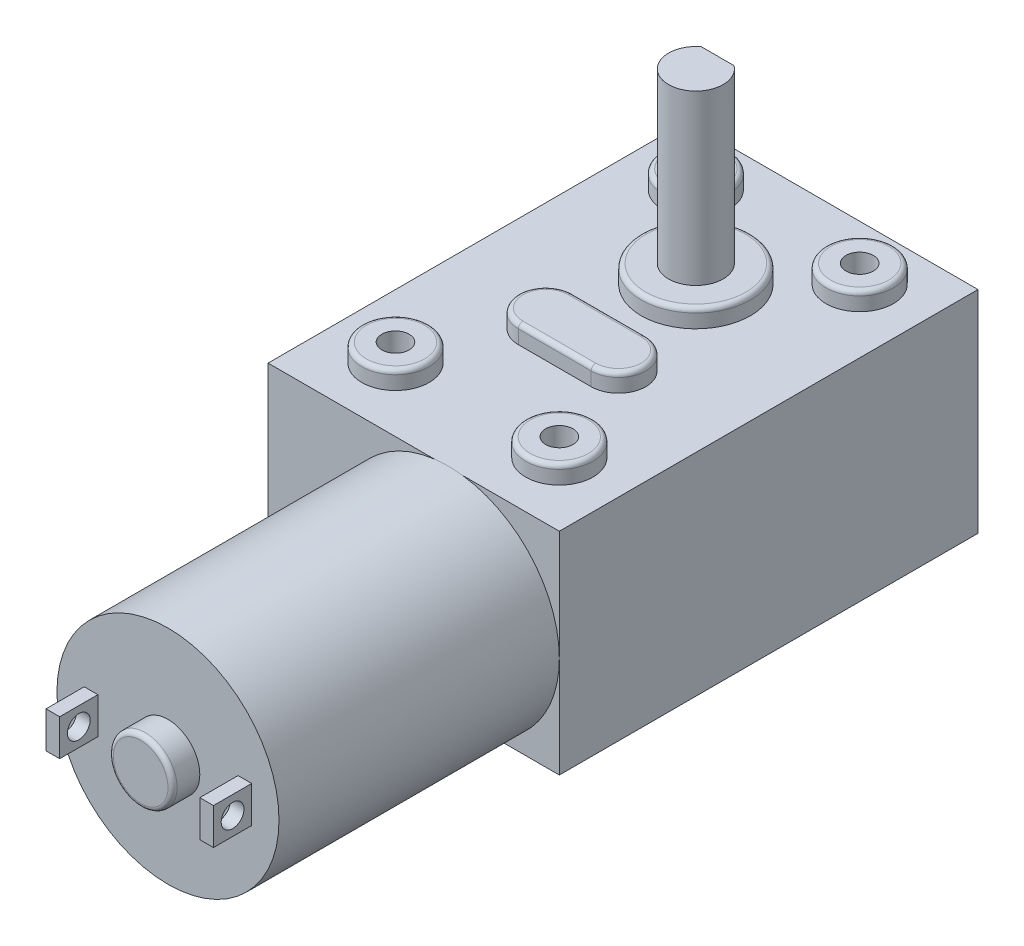
from build123d import *

# Parameters (mm, degrees)
ESBO_O4_R                      = 12.2
RESSALTO_EXTRUS_O3_DEPTH       = 15.4
RESSALTO_EXTRUS_O4_DEPTH       = 12.1
RESSALTO_EXTRUS_O4_DEPTH_BACK  = 11.1
ESBO_O6_W                      = 32
ESBO_O6_H                      = 46
ESBO_O7_R                      = 3.7
ESBO_O7_R_2                    = 6
RESSALTO_EXTRUS_O5_DEPTH       = 2
ESBO_O8_R                      = 3
RESSALTO_EXTRUS_O6_DEPTH       = 18.5
ESBO_O9_W                      = 6
ESBO_O9_H                      = 0.6
CORTE_EXTRUS_O1_DEPTH          = 12
ESBO_O10_R                     = 1.5
CORTE_EXTRUS_O2_EST_DEPTH      = 10
ESBO_O12_W                     = 1.5
ESBO_O12_H                     = 4
RESSALTO_EXTRUS_O8_EST_DEPTH   = 4.2
CORTE_EXTRUS_O3_EST_DEPTH      = 73.28250134
CORTE_EXTRUS_O3_EST_DEPTH_BACK = 73.28250134
ESBO_O13_R                     = 1.25
ESBO_O11_R                     = 3.5
RESSALTO_EXTRUS_O9_EST_DEPTH   = 3
FILETE2_R                      = 0.5


with BuildPart() as part:
    # Esboço4 → Ressalto-extrusão3 (new, symmetric)
    with BuildSketch(Plane.XY):
        with Locations(Location((0, 0, 0), (0, 0, 180))):
            Circle(ESBO_O4_R)
    extrude(amount=RESSALTO_EXTRUS_O3_DEPTH, both=True)

    # Esboço6 → Ressalto-extrusão4 (add, two sides: drawn at the far end of the back side and taken through both)
    with BuildSketch(Plane(origin=(0, 0, 0), x_dir=(1, 0, 0), z_dir=(0, 1, 0)).offset(-RESSALTO_EXTRUS_O4_DEPTH_BACK)):
        with Locations((-3.8, 38.4)):
            Rectangle(ESBO_O6_W, ESBO_O6_H)
    extrude(amount=RESSALTO_EXTRUS_O4_DEPTH + RESSALTO_EXTRUS_O4_DEPTH_BACK)

    # Esboço7 → Ressalto-extrusão5 (add)
    with BuildSketch(Plane(origin=(0, 12.1, 0), x_dir=(1, 0, 0), z_dir=(0, 1, 0))):
        with Locations(Location((-12.8, 55.4, 0), (0, 0, 270))):
            Circle(ESBO_O7_R)
        with Locations(Location((5.2, 55.4, 0), (0, 0, 90))):
            Circle(ESBO_O7_R)
        with Locations(Location((-12.8, 22.4, 0), (0, 0, 270))):
            Circle(ESBO_O7_R)
        with Locations(Location((5.2, 22.4, 0), (0, 0, 90))):
            Circle(ESBO_O7_R)
        with Locations(Location((-3.8, 46.4, 0), (0, 0, 270))):
            Circle(ESBO_O7_R_2)
        with BuildLine():
            Line((-7.8, 36.9), (0.2, 36.9))
            ThreePointArc((0.2, 36.9), (3.2, 33.9), (0.2, 30.9))
            Line((0.2, 30.9), (-7.8, 30.9))
            ThreePointArc((-7.8, 30.9), (-10.8, 33.9), (-7.8, 36.9))
        make_face()
    extrude(amount=RESSALTO_EXTRUS_O5_DEPTH)

    # Esboço8 → Ressalto-extrusão6 (add)
    with BuildSketch(Plane(origin=(0, 14.1, 0), x_dir=(1, 0, 0), z_dir=(0, 1, 0))):
        with Locations(Location((-3.8, 46.4, 0), (0, 0, 270))):
            Circle(ESBO_O8_R)
    extrude(amount=RESSALTO_EXTRUS_O6_DEPTH)

    # Esboço9 → Corte-extrusão1 (cut)
    with BuildSketch(Plane(origin=(0, 32.6, 0), x_dir=(1, 0, 0), z_dir=(0, 1, 0))):
        with Locations((-3.8, 49.1)):
            Rectangle(ESBO_O9_W, ESBO_O9_H)
    extrude(amount=-CORTE_EXTRUS_O1_DEPTH, mode=Mode.SUBTRACT)

    # Esboço10 → Corte-extrusão2 - Est. (cut)
    with BuildSketch(Plane(origin=(0, 14.1, 0), x_dir=(1, 0, 0), z_dir=(0, 1, 0))):
        with Locations(Location((-12.8, 55.4, 0), (0, 0, 270))):
            Circle(ESBO_O10_R)
        with Locations(Location((5.2, 55.4, 0), (0, 0, 270))):
            Circle(ESBO_O10_R)
        with Locations(Location((-12.8, 22.4, 0), (0, 0, 270))):
            Circle(ESBO_O10_R)
        with Locations(Location((5.2, 22.4, 0), (0, 0, 270))):
            Circle(ESBO_O10_R)
    extrude(amount=-CORTE_EXTRUS_O2_EST_DEPTH, mode=Mode.SUBTRACT)

    # Esboço12 → Ressalto-extrusão8 - Est. (add)
    with BuildSketch(Plane.XY.offset(15.4)):
        with Locations((-8.45, 0)):
            Rectangle(ESBO_O12_W, ESBO_O12_H)
        with Locations((8.45, 0)):
            Rectangle(ESBO_O12_W, ESBO_O12_H)
    extrude(amount=RESSALTO_EXTRUS_O8_EST_DEPTH)

    # Esboço13 → Corte-extrusão3 - Est. (cut, two sides: drawn at the far end of the back side and taken through both)
    with BuildSketch(Plane(origin=(0, 0, 0), x_dir=(0, 0, -1), z_dir=(1, 0, 0)).offset(-CORTE_EXTRUS_O3_EST_DEPTH_BACK)):
        with Locations((-17.5, 0)):
            Circle(ESBO_O13_R)
    extrude(amount=CORTE_EXTRUS_O3_EST_DEPTH + CORTE_EXTRUS_O3_EST_DEPTH_BACK, mode=Mode.SUBTRACT)

    # Esboço11 → Ressalto-extrusão9 - Est. (add)
    with BuildSketch(Plane.XY.offset(15.4)):
        Circle(ESBO_O11_R)
    extrude(amount=RESSALTO_EXTRUS_O9_EST_DEPTH)

    # Filete2
    filete2_edges = [part.edges().sort_by_distance(p)[0] for p in [
        (-3.5, 0, 18.4),
        (-12.8, 14.1, -59.1),
        (5.2, 14.1, -51.7),
        (-12.8, 14.1, -26.1),
        (5.2, 14.1, -18.7),
        (-3.8, 14.1, -52.4),
        (-10.8, 14.1, -33.9),
        (-3.8, 14.1, -30.9),
        (3.2, 14.1, -33.9),
        (-3.8, 14.1, -36.9),
    ]]
    fillet(filete2_edges, radius=FILETE2_R)


solid = part.part
